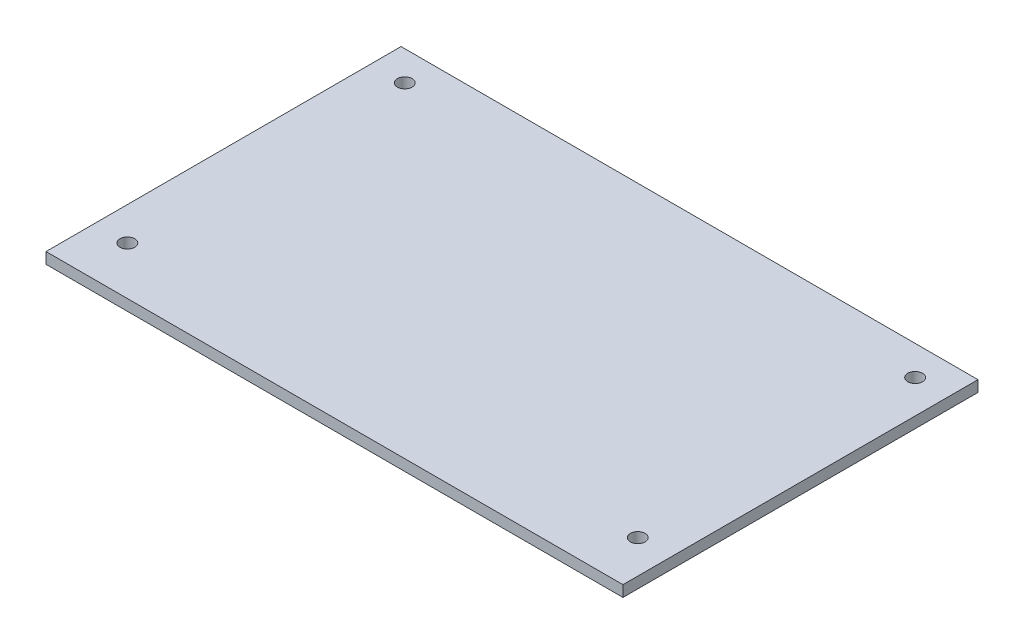
from build123d import *

# Parameters (mm, degrees)
SKETCH1_W           = 78
SKETCH1_H           = 48
BOSS_EXTRUDE1_DEPTH = 1.5
SKETCH2_R           = 1
CUT_EXTRUDE1_DEPTH  = 10


with BuildPart() as part:
    # Sketch1 → Boss-Extrude1 (new body)
    with BuildSketch(Plane(origin=(0, 0, 0), x_dir=(1, 0, 0), z_dir=(0, 1, 0))):
        Rectangle(SKETCH1_W, SKETCH1_H)
    extrude(amount=BOSS_EXTRUDE1_DEPTH)

    # Sketch2 → Cut-Extrude1 (cut)
    with BuildSketch(Plane(origin=(0, 1.5, 0), x_dir=(1, 0, 0), z_dir=(0, 1, 0))):
        with Locations(Location((-34.5, 20, 0), (0, 0, 270))):
            Circle(SKETCH2_R)
        with Locations(Location((34.5, 20, 0), (0, 0, 270))):
            Circle(SKETCH2_R)
        with Locations(Location((-34.5, -17.5, 0), (0, 0, 270))):
            Circle(SKETCH2_R)
        with Locations(Location((34.5, -17.5, 0), (0, 0, 270))):
            Circle(SKETCH2_R)
    extrude(amount=-CUT_EXTRUDE1_DEPTH, mode=Mode.SUBTRACT)


solid = part.part
